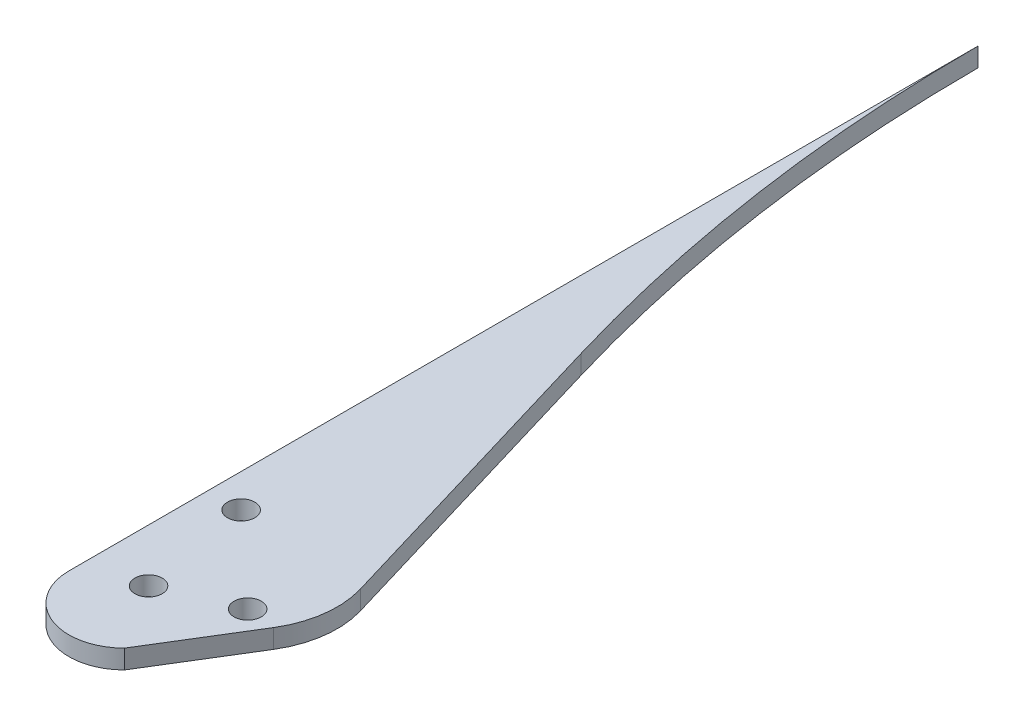
from build123d import *

# Parameters (mm, degrees)
BOSS_EXTRUDE1_DEPTH = 6.35
SKETCH2_W           = 19.05
SKETCH2_H           = 190.5
CUT_EXTRUDE1_DEPTH  = 310.869909223
SKETCH3_R           = 4.572
CUT_EXTRUDE2_DEPTH  = 310.869909223


with BuildPart() as part:
    # Sketch1 → Boss-Extrude1 (new body)
    with BuildSketch(Plane(origin=(0, 0, 0), x_dir=(1, 0, 0), z_dir=(0, 1, 0))):
        with BuildLine():
            Line((31.75, -13.073529412), (50.765202328, 17.881902266))
            ThreePointArc((50.765202328, 17.881902266), (55.191250928, 30.365130488), (54.139291827, 43.567943639))
            Line((54.139291827, 43.567943639), (22.722603429, 148.989996692))
            ThreePointArc((22.722603429, 148.989996692), (5.710537817, 226.070917322), (0, 304.8))
            Line((0, 304.8), (-19.05, 304.8))
            Line((-19.05, 304.8), (-19.05, 114.3))
            Line((-19.05, 114.3), (0, 114.3))
            Line((0, 114.3), (0, 0))
            ThreePointArc((0, 0), (11.497376237, -17.168136702), (31.75, -13.073529412))
        make_face()
    extrude(amount=BOSS_EXTRUDE1_DEPTH)

    # Sketch2 → Cut-Extrude1 (cut, through all)
    with BuildSketch(Plane(origin=(0, 6.35, 0), x_dir=(1, 0, 0), z_dir=(0, 1, 0))):
        with Locations((-9.525, 209.55)):
            Rectangle(SKETCH2_W, SKETCH2_H)
    extrude(amount=-CUT_EXTRUDE1_DEPTH, mode=Mode.SUBTRACT)

    # Sketch3 → Cut-Extrude2 (cut, through all)
    with BuildSketch(Plane(origin=(0, 6.35, 0), x_dir=(1, 0, 0), z_dir=(0, 1, 0))):
        with Locations(Location((11.178180871, 46.576310918, 0), (0, 0, 270))):
            Circle(SKETCH3_R)
        with Locations(Location((17.707917982, 9.005992113, 0), (0, 0, 270))):
            Circle(SKETCH3_R)
        with Locations(Location((41.037990009, 18.900486467, 0), (0, 0, 270))):
            Circle(SKETCH3_R)
    extrude(amount=-CUT_EXTRUDE2_DEPTH, mode=Mode.SUBTRACT)


solid = part.part
